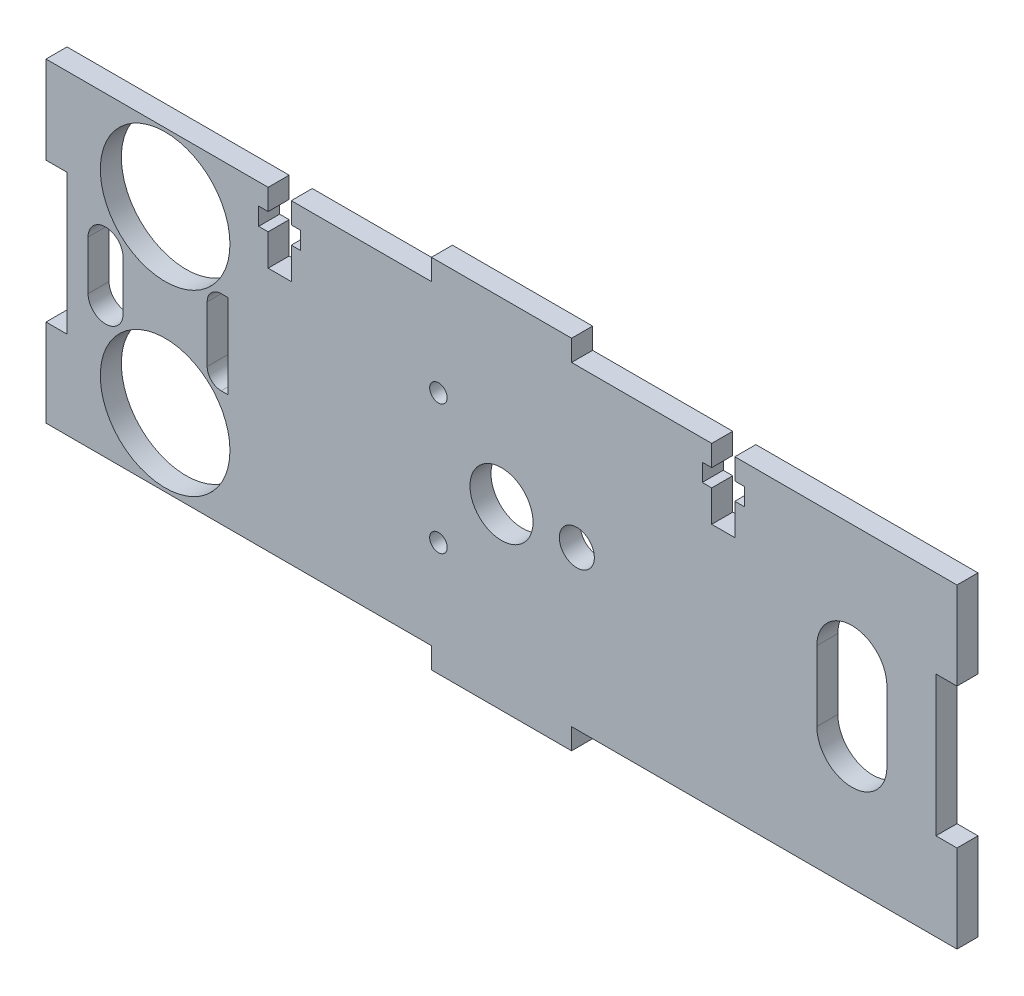
from build123d import *

# Parameters (mm, degrees)
SKETCH1_R           = 9.25
SKETCH1_R_2         = 4.5
SKETCH1_R_3         = 2.5
SKETCH1_R_4         = 1.25
BOSS_EXTRUDE1_DEPTH = 3


with BuildPart() as part:
    # Sketch1 → Boss-Extrude1 (new body)
    with BuildSketch(Plane.XY):
        Polygon((-10, -22.5), (-65, -22.5), (-65, -10), (-62, -10), (-62, 10), (-65, 10), (-65, 22.5), (-33.3, 22.5), (-33.3, 19.5), (-34.65, 19.5), (-34.65, 17), (-33.3, 17), (-33.3, 12.5), (-30, 12.5), (-30, 17), (-28.65, 17), (-28.65, 19.5), (-30, 19.5), (-30, 22.5), (-10, 22.5), (-10, 25.5), (10, 25.5), (10, 22.5), (30, 22.5), (30, 19.5), (28.65, 19.5), (28.65, 17), (30, 17), (30, 12.5), (33.3, 12.5), (33.3, 17), (34.65, 17), (34.65, 19.5), (33.3, 19.5), (33.3, 22.5), (65, 22.5), (65, 10), (62, 10), (62, -10), (65, -10), (65, -22.5), (10, -22.5), (10, -25.5), (-10, -25.5), align=None)
        with Locations((-48, 12.75)):
            Circle(SKETCH1_R, mode=Mode.SUBTRACT)
        with Locations((-48, -12.75)):
            Circle(SKETCH1_R, mode=Mode.SUBTRACT)
        Circle(SKETCH1_R_2, mode=Mode.SUBTRACT)
        with Locations((10.75, 0)):
            Circle(SKETCH1_R_3, mode=Mode.SUBTRACT)
        with Locations((-9, 9.25)):
            Circle(SKETCH1_R_4, mode=Mode.SUBTRACT)
        with Locations(Location((-9, -9.25, 0), (0, 0, 180))):
            Circle(SKETCH1_R_4, mode=Mode.SUBTRACT)
        with BuildLine():
            Line((-54, 3.5), (-54, -3.5))
            ThreePointArc((-54, -3.5), (-56.5, -6), (-59, -3.5))
            Line((-59, -3.5), (-59, 3.5))
            ThreePointArc((-59, 3.5), (-56.5, 6), (-54, 3.5))
        make_face(mode=Mode.SUBTRACT)
        with BuildLine():
            Line((-39, -6), (-40, -6))
            ThreePointArc((-40, -6), (-41.414213562, -5.414213562), (-42, -4))
            Line((-42, -4), (-42, 4))
            ThreePointArc((-42, 4), (-41.414213562, 5.414213562), (-40, 6))
            Line((-40, 6), (-39, 6))
            Line((-39, 6), (-39, -6))
        make_face(mode=Mode.SUBTRACT)
        with BuildLine():
            Line((45, -5), (45, 5))
            ThreePointArc((45, 5), (50, 10), (55, 5))
            Line((55, 5), (55, -5))
            ThreePointArc((55, -5), (50, -10), (45, -5))
        make_face(mode=Mode.SUBTRACT)
    extrude(amount=BOSS_EXTRUDE1_DEPTH)


solid = part.part
